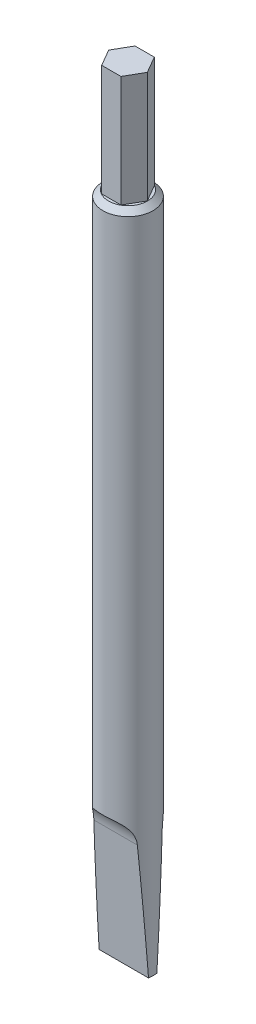
from build123d import *

# Parameters (mm, degrees)
BOSS_EXTRUDE1_DEPTH     = 20
SKETCH2_3_R             = 4.5
BOSS_EXTRUDE2_DEPTH     = 120
CHAMFER1_SIZE           = 1
CUT_EXTRUDE1_DEPTH      = 121.168631514
CUT_EXTRUDE1_DEPTH_BACK = 121.168631514


with BuildPart() as part:
    # Sketch2 → Boss-Extrude1 (new body)
    with BuildSketch(Plane(origin=(0, 0, 0), x_dir=(1, 0, 0), z_dir=(0, 1, 0))):
        Polygon((1.732050808, 3), (-1.732050808, 3), (-3.464101615, 0), (-1.732050808, -3), (1.732050808, -3), (3.464101615, 0), align=None)
    extrude(amount=BOSS_EXTRUDE1_DEPTH)

    # Sketch2<3> → Boss-Extrude2 (add)
    with BuildSketch(Plane(origin=(0, 0, 0), x_dir=(1, 0, 0), z_dir=(0, 1, 0))):
        Circle(SKETCH2_3_R)
    extrude(amount=-BOSS_EXTRUDE2_DEPTH)

    # Chamfer1
    chamfer1_edges = [part.edges().sort_by_distance(p)[0] for p in [
        (-4.5, 0, 0),
    ]]
    chamfer(chamfer1_edges, length=CHAMFER1_SIZE)

    # Sketch3 → Cut-Extrude1 (cut, two sides: drawn at the far end of the back side and taken through both)
    with BuildSketch(Plane(origin=(0, 0, 0), x_dir=(0, 0, -1), z_dir=(1, 0, 0)).offset(-CUT_EXTRUDE1_DEPTH_BACK)):
        with BuildLine():
            Line((4.5, -95), (4.5, -120))
            Line((4.5, -120), (0.75, -120))
            Line((0.75, -120), (2.229044758, -98.848674543))
            ThreePointArc((2.229044758, -98.848674543), (2.910634909, -96.656515683), (4.5, -95))
        make_face()
        with BuildLine():
            Line((-0.75, -120), (-2.229044758, -98.848674543))
            ThreePointArc((-2.229044758, -98.848674543), (-2.910634909, -96.656515683), (-4.5, -95))
            Line((-4.5, -95), (-4.5, -120))
            Line((-4.5, -120), (-0.75, -120))
        make_face()
    extrude(amount=CUT_EXTRUDE1_DEPTH + CUT_EXTRUDE1_DEPTH_BACK, mode=Mode.SUBTRACT)


solid = part.part
